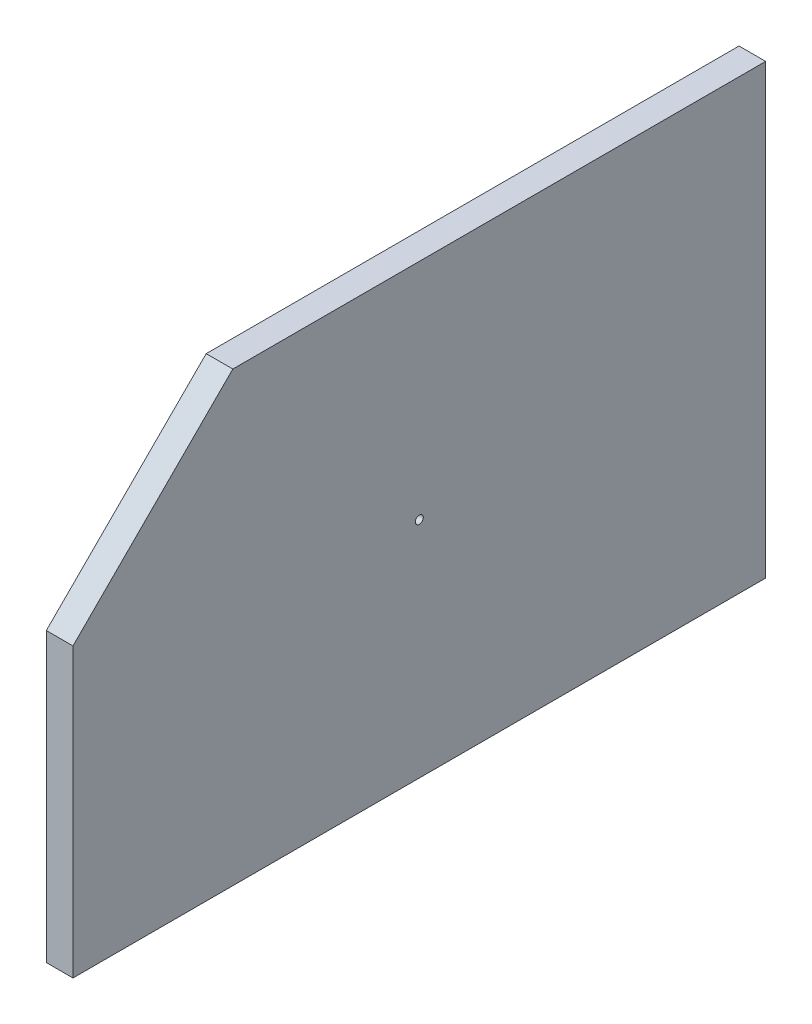
from build123d import *

# Parameters (mm, degrees)
Y_KSEKLIK_EKSTR_ZYON1_DEPTH = 10
SKETCH3_R                   = 1.5
CUT_EXTRUDE1_DEPTH          = 10


with BuildPart() as part:
    # Çizim1 → Yükseklik-Ekstrüzyon1 (new body)
    with BuildSketch(Plane(origin=(0, 0, 0), x_dir=(0, 0, -1), z_dir=(1, 0, 0))):
        Polygon((0, 0), (260, 0), (260, 167.95), (60, 167.95), (0, 107.95), align=None)
    extrude(amount=Y_KSEKLIK_EKSTR_ZYON1_DEPTH)

    # Sketch3 → Cut-Extrude1 (cut)
    with BuildSketch(Plane(origin=(10, 0, 0), x_dir=(0, 0, -1), z_dir=(1, 0, 0))):
        with Locations((130, 83.975)):
            Circle(SKETCH3_R)
    extrude(amount=-CUT_EXTRUDE1_DEPTH, mode=Mode.SUBTRACT)


solid = part.part
